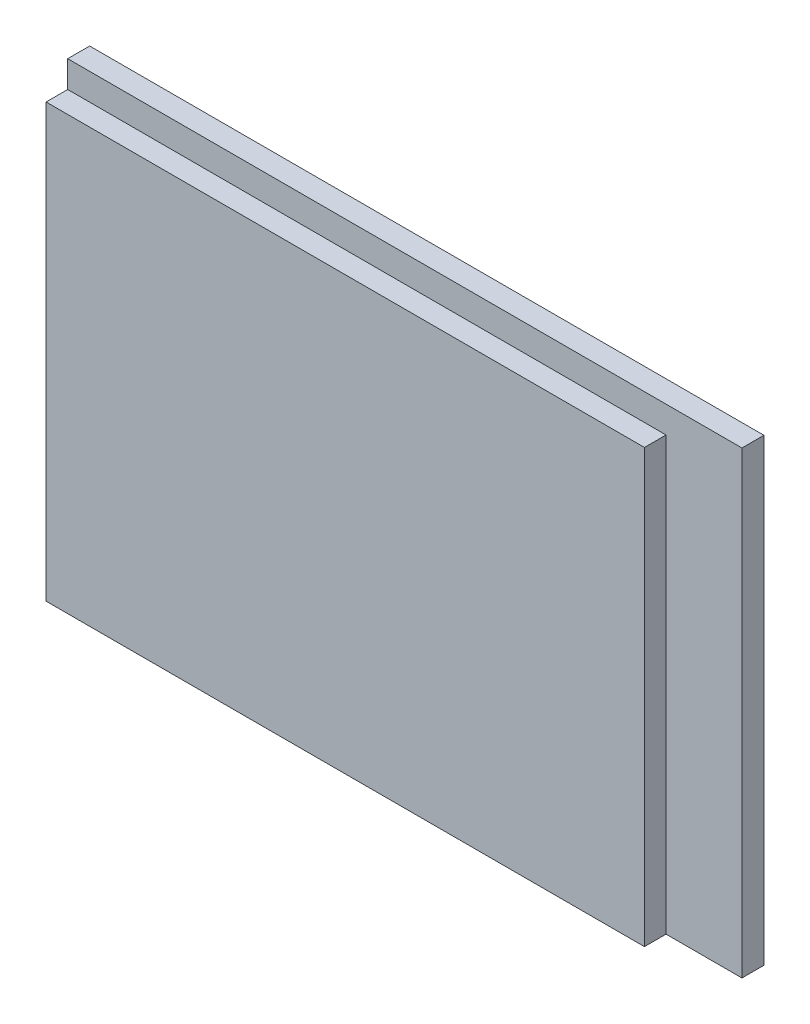
from build123d import *

# Parameters (mm, degrees)
SKETCH1_W           = 77.978
SKETCH1_H           = 53.086
BOSS_EXTRUDE1_DEPTH = 2.54
SKETCH2_W           = 69.2
SKETCH2_H           = 50
BOSS_EXTRUDE2_DEPTH = 2.5


with BuildPart() as part:
    # Sketch1 → Boss-Extrude1 (new body)
    with BuildSketch(Plane.XY):
        Rectangle(SKETCH1_W, SKETCH1_H)
    extrude(amount=BOSS_EXTRUDE1_DEPTH)

    # Sketch2 → Boss-Extrude2 (add)
    with BuildSketch(Plane.XY.offset(2.54)):
        with Locations((-4.389, -1.543)):
            Rectangle(SKETCH2_W, SKETCH2_H)
    extrude(amount=BOSS_EXTRUDE2_DEPTH)


solid = part.part
